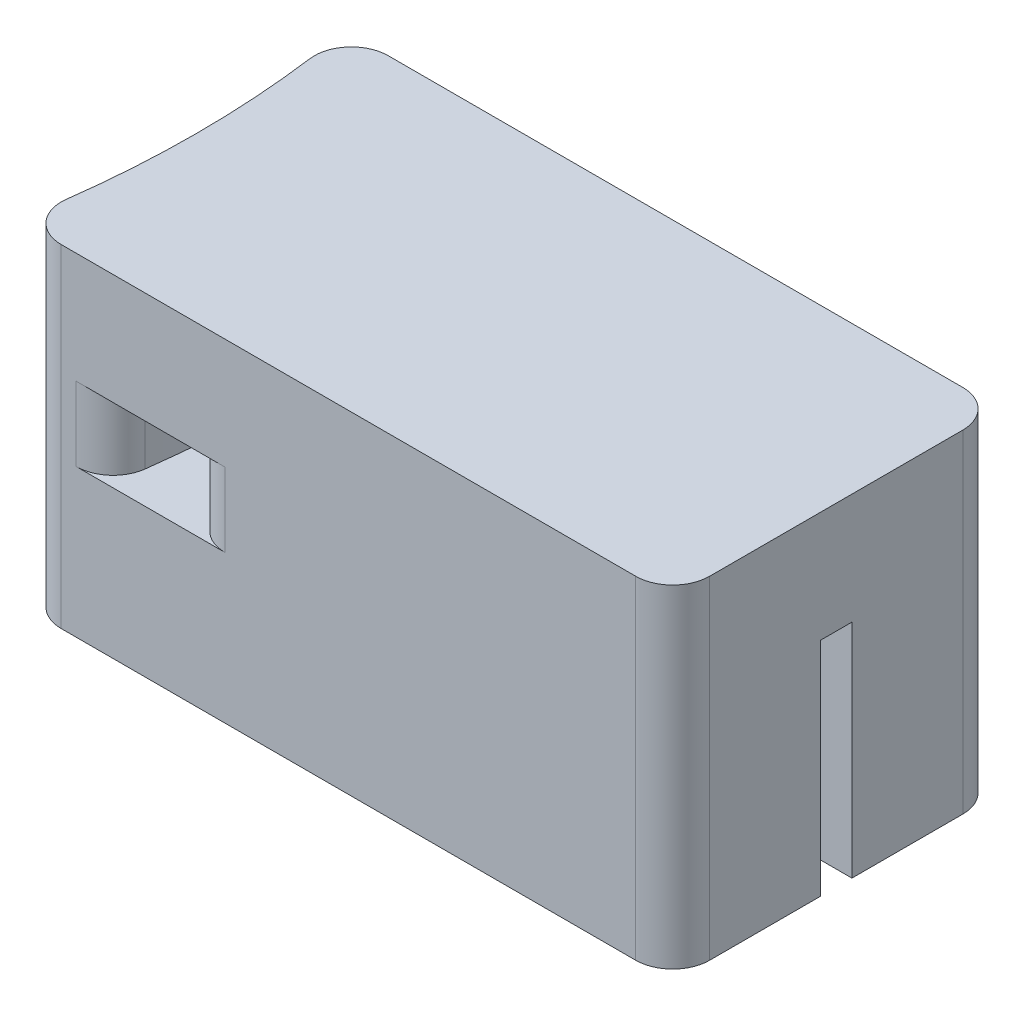
from build123d import *

# Parameters (mm, degrees)
BOSS_EXTRUDE2_DEPTH   = 6
SKETCH3_W             = 2.51964915
SKETCH3_H             = 4
BOSS_EXTRUDE2_2_DEPTH = 6
LPATTERN1_COUNT       = 5
LPATTERN1_PITCH       = 2
SKETCH4_W             = 10.51964915
SKETCH4_H             = 8.85
BOSS_EXTRUDE3_DEPTH   = 3
BOSS_EXTRUDE7_DEPTH   = 3
BOSS_EXTRUDE8_START   = -3
BOSS_EXTRUDE8_DEPTH   = 2
BOSS_EXTRUDE9_START   = -5
BOSS_EXTRUDE9_DEPTH   = 4
FILLET1_R             = 1


with BuildPart() as part:
    # Sketch3 → Boss-Extrude2 (new body)
    with BuildSketch(Plane(origin=(0, 0, 0), x_dir=(-1, 0, 0), z_dir=(0, 1, 0))):
        with BuildLine():
            Line((0, 0.425), (0.51964915, 0.425))
            ThreePointArc((0.51964915, 0.425), (0.618556221, 0.462228588), (0.668367684, 0.555434783))
            ThreePointArc((0.668367684, 0.555434783), (0.702212861, 0.713062154), (0.76094817, 0.863202247))
            ThreePointArc((0.76094817, 0.863202247), (1.259824575, 1.175), (1.758700979, 0.863202247))
            ThreePointArc((1.758700979, 0.863202247), (1.817436289, 0.713062154), (1.851281466, 0.555434783))
            ThreePointArc((1.851281466, 0.555434783), (1.901092929, 0.462228588), (2, 0.425))
            Line((2, 0.425), (2.51964915, 0.425))
            Line((2.51964915, 0.425), (2.51964915, 4.425))
            Line((2.51964915, 4.425), (0, 4.425))
            Line((0, 4.425), (0, 0.425))
        make_face()
    boss_extrude2 = extrude(amount=BOSS_EXTRUDE2_DEPTH)


with BuildPart() as body_2:
    # Sketch3 → Boss-Extrude2 2 (new body)
    with BuildSketch(Plane(origin=(0, 0, 0), x_dir=(-1, 0, 0), z_dir=(0, 1, 0))):
        with Locations((1.259824575, -2.425)):
            Rectangle(SKETCH3_W, SKETCH3_H)
    boss_extrude2_2 = extrude(amount=BOSS_EXTRUDE2_2_DEPTH)


with BuildPart() as part_1:
    add(part.part)

    add(body_2.part)  # LPattern1 merges body 2
    # LPattern1: Boss-Extrude2, Boss-Extrude2 2 ×5
    with Locations(*[(i * LPATTERN1_PITCH, 0, 0) for i in range(1, LPATTERN1_COUNT)]):
        add(boss_extrude2)
        add(boss_extrude2_2)

    # Sketch4 → Boss-Extrude3 (add)
    with BuildSketch(Plane(origin=(0, 6, 0), x_dir=(1, 0, 0), z_dir=(0, 1, 0))):
        with Locations((2.740175425, 0)):
            Rectangle(SKETCH4_W, SKETCH4_H)
    extrude(amount=BOSS_EXTRUDE3_DEPTH)

    # Sketch8 → Boss-Extrude7 (add)
    with BuildSketch(Plane(origin=(0, 9, 0), x_dir=(1, 0, 0), z_dir=(0, 1, 0))):
        with BuildLine():
            Line((-2.51964915, 4.425), (-9.714377865, 4.425))
            ThreePointArc((-9.714377865, 4.425), (-9.31964915, 0), (-9.714377865, -4.425))
            Line((-9.714377865, -4.425), (-2.51964915, -4.425))
            Line((-2.51964915, -4.425), (-2.51964915, 4.425))
        make_face()
    extrude(amount=-BOSS_EXTRUDE7_DEPTH)

    # Sketch8<3> → Boss-Extrude8 (add)
    with BuildSketch(Plane(origin=(0, 9, 0), x_dir=(1, 0, 0), z_dir=(0, 1, 0)).offset(BOSS_EXTRUDE8_START)):
        with BuildLine():
            ThreePointArc((-7.279320472, -4.425), (-6.91964915, 0), (-7.279320472, 4.425))
            Line((-7.279320472, 4.425), (-9.714377865, 4.425))
            ThreePointArc((-9.714377865, 4.425), (-9.31964915, 0), (-9.714377865, -4.425))
            Line((-9.714377865, -4.425), (-7.279320472, -4.425))
        make_face()
        with BuildLine():
            Line((-2.51964915, -4.425), (-2.51964915, 4.425))
            Line((-2.51964915, 4.425), (-5.254560555, 4.425))
            ThreePointArc((-5.254560555, 4.425), (-4.91964915, 0), (-5.254560555, -4.425))
            Line((-5.254560555, -4.425), (-2.51964915, -4.425))
        make_face()
    extrude(amount=-BOSS_EXTRUDE8_DEPTH)

    # Sketch8<4> → Boss-Extrude9 (add)
    with BuildSketch(Plane(origin=(0, 9, 0), x_dir=(1, 0, 0), z_dir=(0, 1, 0)).offset(BOSS_EXTRUDE9_START)):
        with BuildLine():
            Line((-2.51964915, 4.425), (-9.714377865, 4.425))
            ThreePointArc((-9.714377865, 4.425), (-9.31964915, 0), (-9.714377865, -4.425))
            Line((-9.714377865, -4.425), (-2.51964915, -4.425))
            Line((-2.51964915, -4.425), (-2.51964915, 4.425))
        make_face()
    extrude(amount=-BOSS_EXTRUDE9_DEPTH)

    # Fillet1
    fillet1_edges = [part_1.edges().sort_by_distance(p)[0] for p in [
        (8, 4.5, 4.425),
        (8, 4.5, -4.425),
        (-9.714377865, 4.5, 4.425),
        (-9.714377865, 4.5, -4.425),
        (-7.279320472, 5, -4.425),
        (-7.279320472, 5, 4.425),
        (-5.254560555, 5, 4.425),
        (-5.254560555, 5, -4.425),
    ]]
    fillet(fillet1_edges, radius=FILLET1_R)


solid = part_1.part
